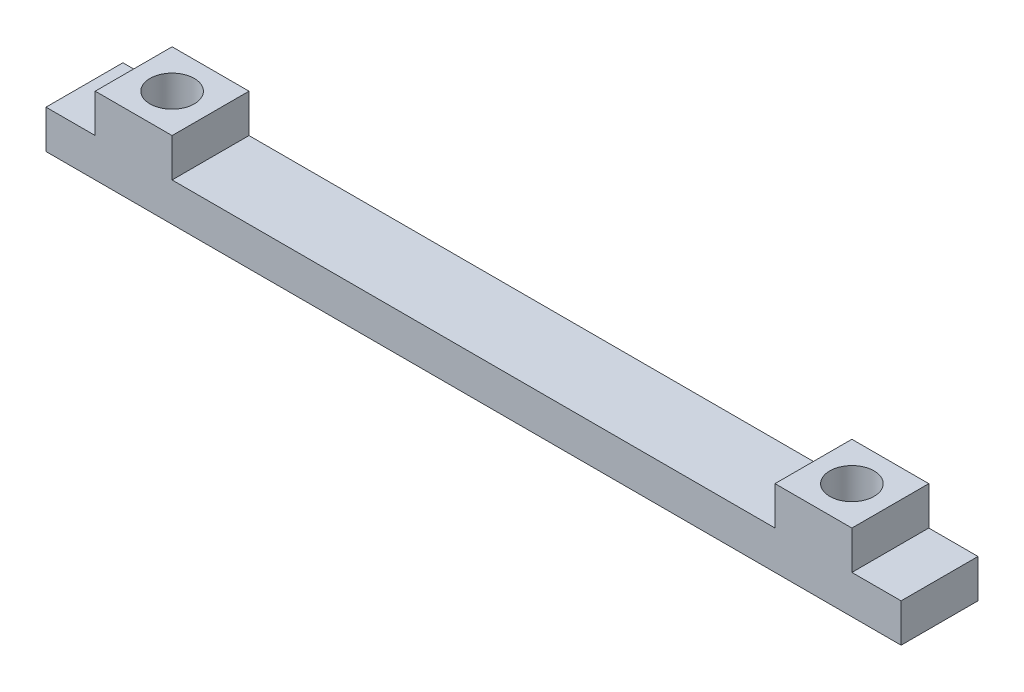
from build123d import *

# Parameters (mm, degrees)
SKETCH1_W             = 6.35
SKETCH1_H             = 3.175
BOSS_EXTRUDE1_DEPTH   = 6.35
F_6_CLEARANCE_HOLE1_D = 3.6576


with BuildPart() as part:
    # Sketch1 → Boss-Extrude1 (new body)
    with BuildSketch(Plane.XY):
        Polygon((0, 0), (35.306, 0), (35.306, 3.175), (10.414, 3.175), (4.064, 3.175), (0, 3.175), align=None)
        with Locations((7.239, 4.7625)):
            Rectangle(SKETCH1_W, SKETCH1_H)
        with Locations((63.373, 4.7625)):
            Rectangle(SKETCH1_W, SKETCH1_H)
        Polygon((35.306, 3.175), (35.306, 0), (70.612, 0), (70.612, 3.175), (66.548, 3.175), (60.198, 3.175), align=None)
    extrude(amount=BOSS_EXTRUDE1_DEPTH)

    # #6 Clearance Hole1 (through all)
    with Locations(Plane(origin=(7.239, 0, 3.175), x_dir=(0, 0, -1), z_dir=(0, -1, 0))):
        with Locations((0, 0), (0, 56.134)):
            Hole(F_6_CLEARANCE_HOLE1_D / 2)


solid = part.part
